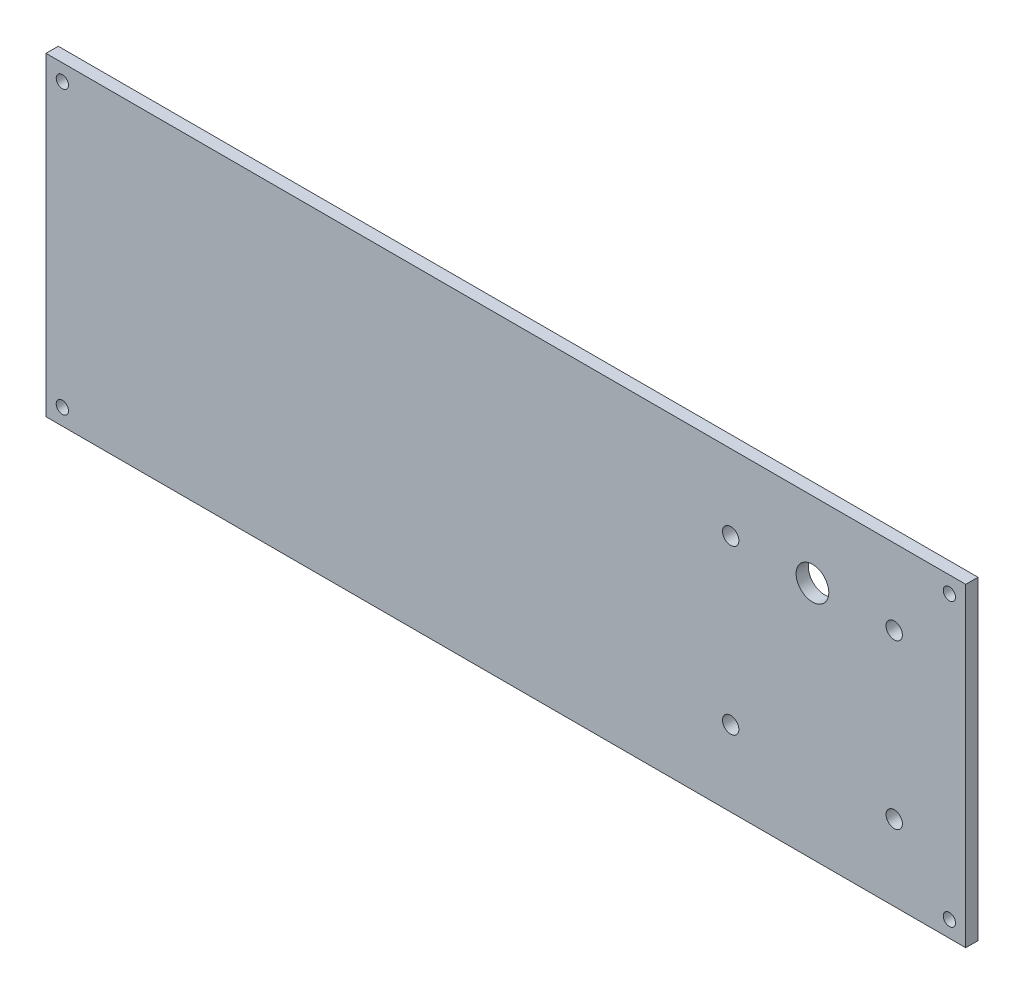
from build123d import *

# Parameters (mm, degrees)
SKETCH_1_W      = 225
SKETCH_1_H      = 77
SKETCH_1_R      = 1.5
SKETCH_1_R_2    = 2
SKETCH_1_R_3    = 4
EXTRUDE_1_DEPTH = 3


with BuildPart() as part:
    # 草图1 → 凸台-拉伸1 (new body)
    with BuildSketch(Plane.XY):
        with Locations((-100.653153153, -12.882882883)):
            Rectangle(SKETCH_1_W, SKETCH_1_H)
        with Locations((-209.153153153, 21.617117117)):
            Circle(SKETCH_1_R, mode=Mode.SUBTRACT)
        with Locations((7.846846847, 21.617117117)):
            Circle(SKETCH_1_R, mode=Mode.SUBTRACT)
        with Locations((-209.153153153, -47.382882883)):
            Circle(SKETCH_1_R, mode=Mode.SUBTRACT)
        with Locations((7.846846847, -47.382882883)):
            Circle(SKETCH_1_R, mode=Mode.SUBTRACT)
        with Locations((-5.653153153, -32.882882883)):
            Circle(SKETCH_1_R_2, mode=Mode.SUBTRACT)
        with Locations((-45.653153153, -32.882882883)):
            Circle(SKETCH_1_R_2, mode=Mode.SUBTRACT)
        with Locations((-45.653153153, 7.117117117)):
            Circle(SKETCH_1_R_2, mode=Mode.SUBTRACT)
        with Locations((-5.653153153, 7.117117117)):
            Circle(SKETCH_1_R_2, mode=Mode.SUBTRACT)
        with Locations((-25.653153153, 7.117117117)):
            Circle(SKETCH_1_R_3, mode=Mode.SUBTRACT)
    extrude(amount=EXTRUDE_1_DEPTH)


solid = part.part
